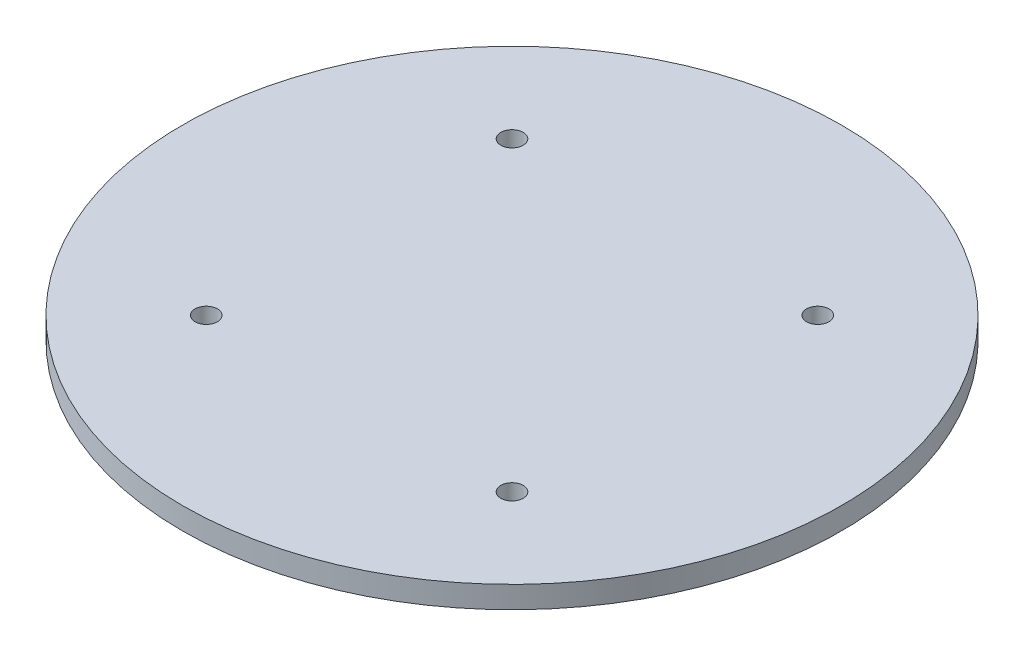
from build123d import *

# Parameters (mm, degrees)
SKETCH_1_R      = 75
EXTRUDE_1_DEPTH = 5
HOLE_WIZARD_2_D = 5.1


with BuildPart() as part:
    # 草图1 → 凸台-拉伸1 (new body)
    with BuildSketch(Plane(origin=(0, 0, 0), x_dir=(1, 0, 0), z_dir=(0, 1, 0))):
        with Locations(Location((0, 0, 0), (0, 0, 270))):
            Circle(SKETCH_1_R)
    extrude(amount=EXTRUDE_1_DEPTH)

    # 孔2 (through all)
    with Locations(Plane.XZ):
        with Locations((34.79, -34.79), (34.79, 34.79), (-34.79, -34.79), (-34.79, 34.79)):
            Hole(HOLE_WIZARD_2_D / 2)


solid = part.part
